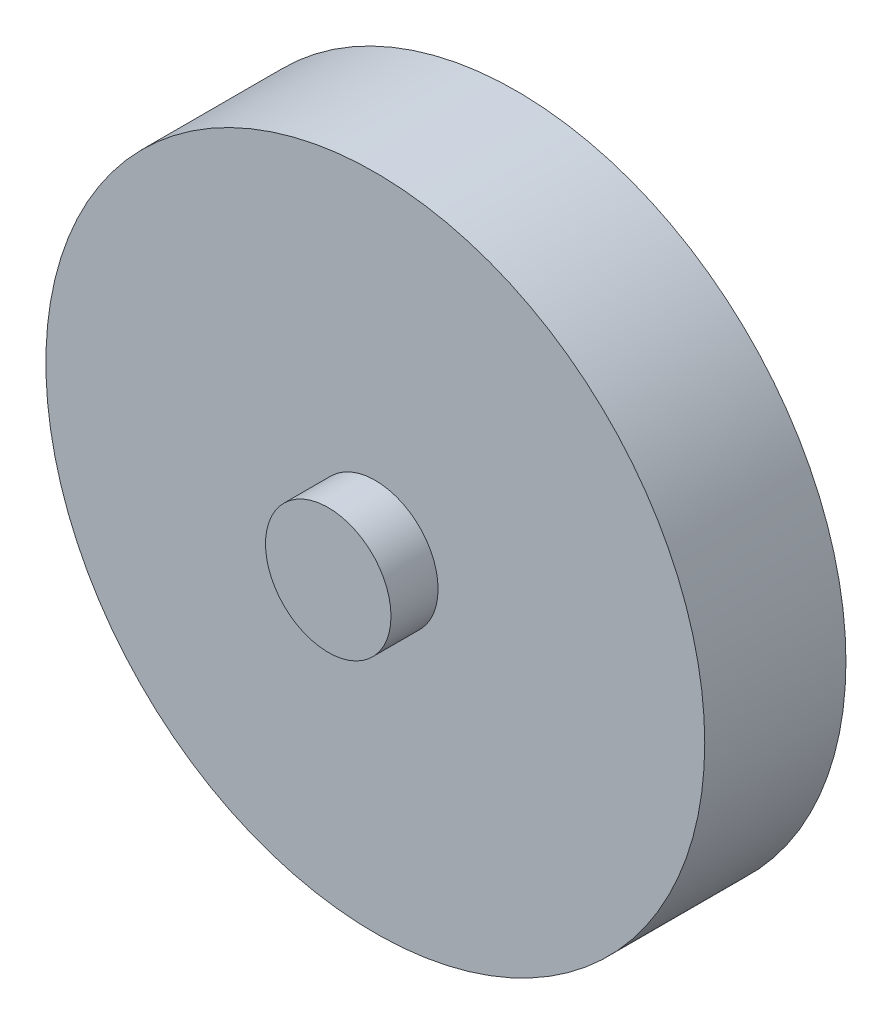
from build123d import *

# Parameters (mm, degrees)
SKETCH_1_R      = 8
EXTRUDE_1_DEPTH = 24
SKETCH_2_R      = 42
EXTRUDE_2_DEPTH = 18
SKETCH_4_R      = 8
EXTRUDE_3_DEPTH = 6


with BuildPart() as part:
    # 草图1 → 凸台-拉伸1 (new body)
    with BuildSketch(Plane.XY):
        Circle(SKETCH_1_R)
    extrude(amount=EXTRUDE_1_DEPTH)

    # 草图2 → 凸台-拉伸2 (add)
    with BuildSketch(Plane.XY):
        Circle(SKETCH_2_R)
    extrude(amount=EXTRUDE_2_DEPTH)

    # 草图4 → 凸台-拉伸3 (add)
    with BuildSketch(Plane.XY):
        Circle(SKETCH_4_R)
    extrude(amount=EXTRUDE_3_DEPTH)


solid = part.part
